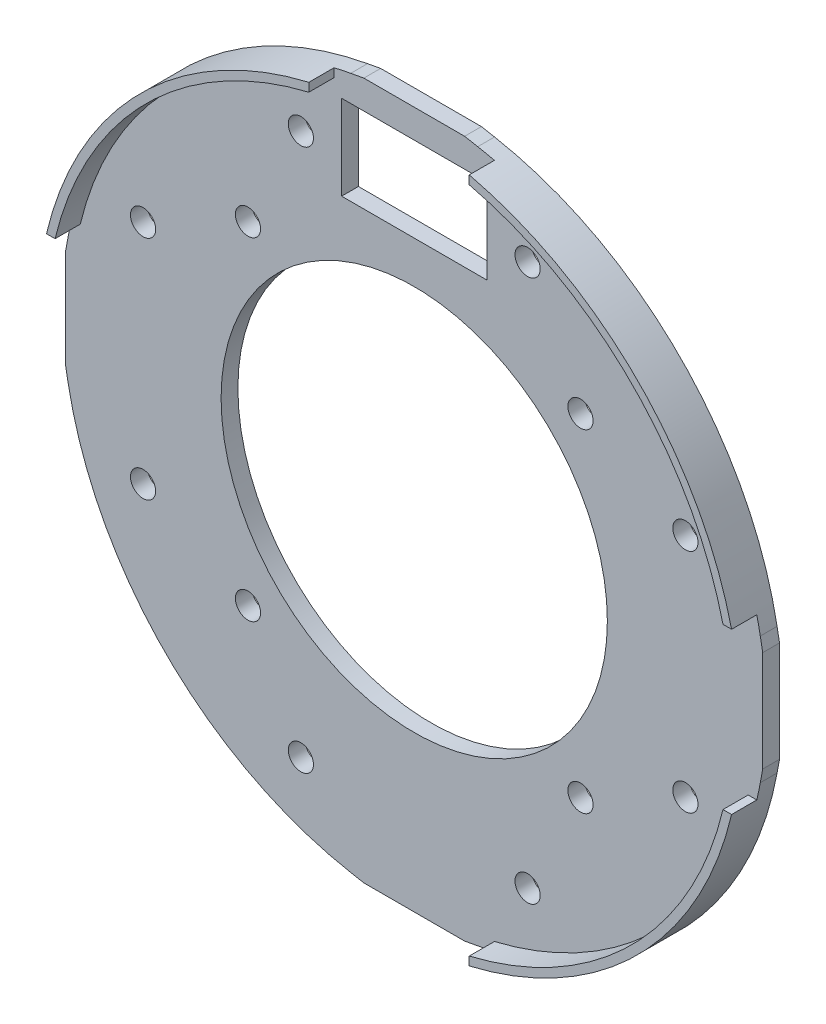
from build123d import *

# Parameters (mm, degrees)
EXTRUDE_1_DEPTH          = 2
HOLE_WIZARD_3_0_3_1_D    = 3
HOLE_WIZARD_M421_D       = 46
FILLET_1_R               = 42
EXTRUDE_2_DEPTH          = 3
PATTERN_CIRCULAR_1_COUNT = 3
PATTERN_CIRCULAR_1_ANGLE = 180
SKETCH_12_W              = 17.29
SKETCH_12_H              = 10.1
CUT_EXTRUDE_2_DEPTH      = 10


with BuildPart() as part:
    # Эскиз1 → Бобышка-Вытянуть1 (new body)
    with BuildSketch(Plane.XY.offset(-2)):
        Polygon((41.5, 6), (35.95120701, 35.95120701), (6, 41.5), (-6, 41.5), (-35.95120701, 35.95120701), (-41.5, 6), (-41.5, -6), (-35.95120701, -35.95120701), (-6, -41.5), (6, -41.5), (35.95120701, -35.95120701), (41.5, -6), align=None)
    extrude(amount=-EXTRUDE_1_DEPTH)

    # Диаметр отверстия Ø3.0 (3)1 (through all)
    with Locations(Plane.XY.offset(-2)):
        with Locations((32.291639785, -13.5), (32.291639785, 13.5), (19.798989873, 19.798989873), (19.798989873, -19.798989873), (13.5, -32.291639785), (-13.5, -32.291639785), (-19.798989873, -19.798989873), (-19.798989873, 19.798989873), (-13.5, 32.291639785), (13.5, 32.291639785), (-32.291639785, 13.5), (-32.291639785, -13.5)):
            Hole(HOLE_WIZARD_3_0_3_1_D / 2)

    # Отверстие с зазором M421 (through all)
    with Locations(Plane.XY.offset(-2)):
        with Locations((0, 0)):
            Hole(HOLE_WIZARD_M421_D / 2)

    # Скругление1
    fillet_1_edges = [part.edges().sort_by_distance(p)[0] for p in [
        (35.95120701, -35.95120701, -3),
        (-35.95120701, -35.95120701, -3),
        (-35.95120701, 35.95120701, -3),
        (35.95120701, 35.95120701, -3),
    ]]
    fillet(fillet_1_edges, radius=FILLET_1_R)

    # Эскиз10 → Бобышка-Вытянуть2 (add)
    with BuildSketch(Plane.XY.offset(-2)):
        with BuildLine():
            Line((-9.549876115, 39.769458963), (-9.549876115, 40.792474564))
            ThreePointArc((-9.549876115, 40.792474564), (-29.611492945, 29.611492945), (-40.792474564, 9.549876115))
            Line((-40.792474564, 9.549876115), (-39.769458963, 9.549876115))
            ThreePointArc((-39.769458963, 9.549876115), (-28.920667351, 28.920667351), (-9.549876115, 39.769458963))
        make_face()
    extrude_2 = extrude(amount=EXTRUDE_2_DEPTH)

    # Круговой массив1: Бобышка-Вытянуть2 ×3 about axis
    pattern_circular_1_axis = Axis((0, 0, 0), (0, 0, -1))
    for i in range(1, PATTERN_CIRCULAR_1_COUNT):
        add(extrude_2.rotate(pattern_circular_1_axis, i * PATTERN_CIRCULAR_1_ANGLE / (PATTERN_CIRCULAR_1_COUNT - 1)))

    # Эскиз12 → Вырез-Вытянуть2 (cut)
    with BuildSketch(Plane(origin=(0, 0, -4), x_dir=(-1, 0, 0), z_dir=(0, 0, -1))):
        with Locations((0, 33.05)):
            Rectangle(SKETCH_12_W, SKETCH_12_H)
    extrude(amount=-CUT_EXTRUDE_2_DEPTH, mode=Mode.SUBTRACT)


solid = part.part
